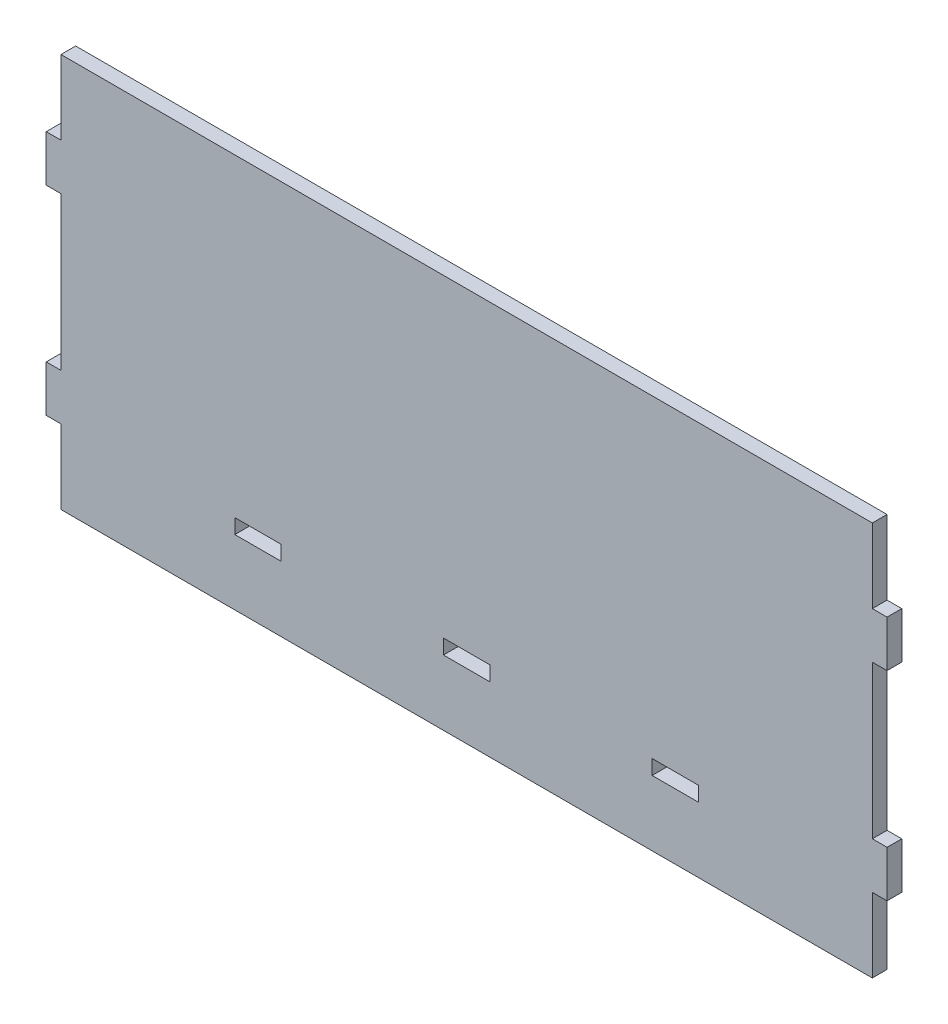
from build123d import *

# Parameters (mm, degrees)
CROQUIS1_W              = 350
CROQUIS1_H              = 170
SALIENTE_EXTRUIR1_DEPTH = 6.35
CROQUIS2_W              = 6.35
CROQUIS2_H              = 20
SALIENTE_EXTRUIR2_DEPTH = 6.35
CROQUIS4_W              = 20
CROQUIS4_H              = 6.35
CORTAR_EXTRUIR1_DEPTH   = 10


with BuildPart() as part:
    # Croquis1 → Saliente-Extruir1 (new body)
    with BuildSketch(Plane.XY):
        with Locations((18.650000026, 65)):
            Rectangle(CROQUIS1_W, CROQUIS1_H)
    extrude(amount=SALIENTE_EXTRUIR1_DEPTH)

    # Croquis2 → Saliente-Extruir2 (add)
    with BuildSketch(Plane.ZY.offset(156.349999974)):
        with Locations((3.175, 108)):
            Rectangle(CROQUIS2_W, CROQUIS2_H)
        with Locations((3.175, 22)):
            Rectangle(CROQUIS2_W, CROQUIS2_H)
    saliente_extruir2 = extrude(amount=SALIENTE_EXTRUIR2_DEPTH)

    # Simetría1: Saliente-Extruir2 across plane
    add(saliente_extruir2.mirror(Plane(origin=(18.650000026, 0, 0), x_dir=(0, 0, 1), z_dir=(1, 0, 0))))

    # Croquis4 → Cortar-Extruir1 (cut)
    with BuildSketch(Plane.XY.offset(6.35)):
        with Locations((18.650000026, 11.335)):
            Rectangle(CROQUIS4_W, CROQUIS4_H)
        with Locations((108.650000026, 11.335)):
            Rectangle(CROQUIS4_W, CROQUIS4_H)
        with Locations((-71.349999974, 11.335)):
            Rectangle(CROQUIS4_W, CROQUIS4_H)
    extrude(amount=-CORTAR_EXTRUIR1_DEPTH, mode=Mode.SUBTRACT)


solid = part.part
